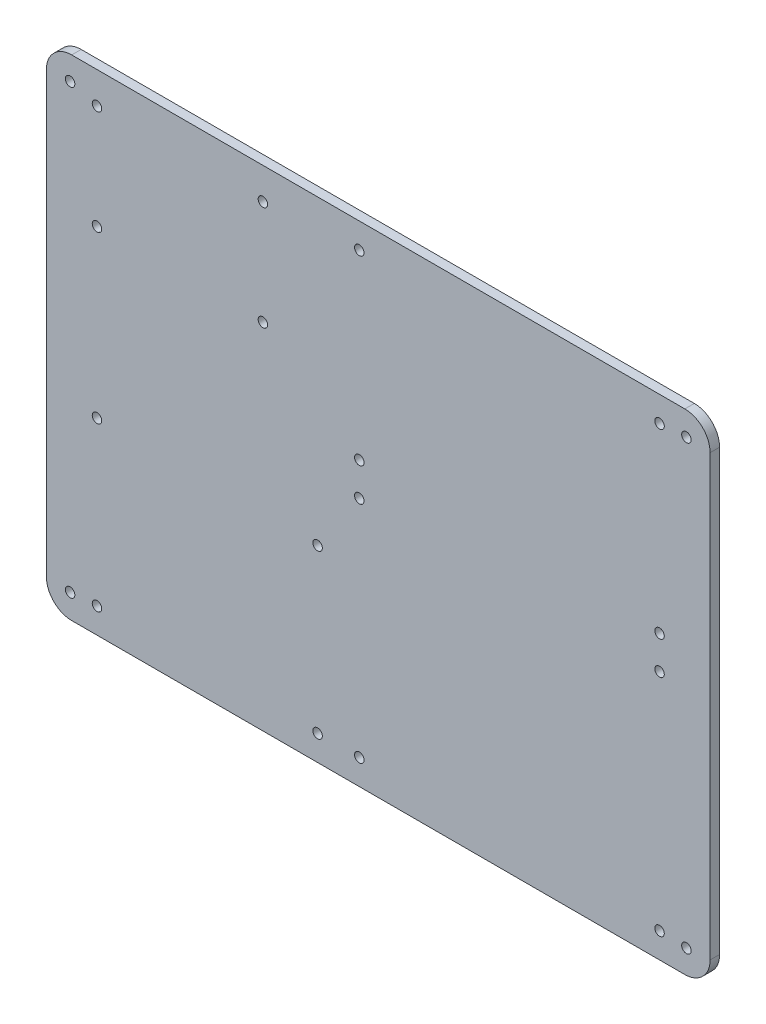
from build123d import *

# Parameters (mm, degrees)
SKETCH1_R           = 1.5
BOSS_EXTRUDE1_DEPTH = 3
SKETCH2_R           = 1.5
LVPCB_HOLE_DEPTH    = 20
SKETCH4_R           = 1.5
SDC_HOLE_DEPTH      = 10
SKETCH3_R           = 1.5
TSAL_LV_HOLE_DEPTH  = 10
SKETCH5_R           = 1.5
BSPD_HOLE_DEPTH     = 10


with BuildPart() as part:
    # Sketch1 → Boss-Extrude1 (new body)
    with BuildSketch(Plane.XY):
        with BuildLine():
            Line((-97, 77.5), (97, 77.5))
            ThreePointArc((97, 77.5), (102.656854249, 75.156854249), (105, 69.5))
            Line((105, 69.5), (105, -69.5))
            ThreePointArc((105, -69.5), (102.656854249, -75.156854249), (97, -77.5))
            Line((97, -77.5), (-97, -77.5))
            ThreePointArc((-97, -77.5), (-102.656854249, -75.156854249), (-105, -69.5))
            Line((-105, -69.5), (-105, 69.5))
            ThreePointArc((-105, 69.5), (-102.656854249, 75.156854249), (-97, 77.5))
        make_face()
        with Locations((-97.5, 70)):
            Circle(SKETCH1_R, mode=Mode.SUBTRACT)
        with Locations((97.5, 70)):
            Circle(SKETCH1_R, mode=Mode.SUBTRACT)
        with Locations((-97.5, -70)):
            Circle(SKETCH1_R, mode=Mode.SUBTRACT)
        with Locations((97.5, -70)):
            Circle(SKETCH1_R, mode=Mode.SUBTRACT)
    extrude(amount=BOSS_EXTRUDE1_DEPTH)

    # Sketch2 → LVPCB Hole (cut)
    with BuildSketch(Plane.XY.offset(3)):
        with Locations((-6, 69.5)):
            Circle(SKETCH2_R)
        with Locations((89, 69.5)):
            Circle(SKETCH2_R)
        with Locations((-6, 12)):
            Circle(SKETCH2_R)
        with Locations((89, 12)):
            Circle(SKETCH2_R)
    extrude(amount=-LVPCB_HOLE_DEPTH, mode=Mode.SUBTRACT)

    # Sketch4 → SDC Hole (cut)
    with BuildSketch(Plane.XY.offset(3)):
        with Locations((-6, 1.5)):
            Circle(SKETCH4_R)
        with Locations((89, 1.5)):
            Circle(SKETCH4_R)
        with Locations((-6, -69.5)):
            Circle(SKETCH4_R)
        with Locations((89, -69.5)):
            Circle(SKETCH4_R)
    extrude(amount=-SDC_HOLE_DEPTH, mode=Mode.SUBTRACT)

    # Sketch3 → TSAL LV Hole (cut)
    with BuildSketch(Plane.XY.offset(3)):
        with Locations((-89, -18)):
            Circle(SKETCH3_R)
        with Locations((-19.2, -18)):
            Circle(SKETCH3_R)
        with Locations((-89, -69.5)):
            Circle(SKETCH3_R)
        with Locations((-19.2, -69.5)):
            Circle(SKETCH3_R)
    extrude(amount=-TSAL_LV_HOLE_DEPTH, mode=Mode.SUBTRACT)

    # Sketch5 → BSPD Hole (cut)
    with BuildSketch(Plane.XY.offset(3)):
        with Locations((-89, 67.5)):
            Circle(SKETCH5_R)
        with Locations((-36.5, 67.5)):
            Circle(SKETCH5_R)
        with Locations((-89, 34.5)):
            Circle(SKETCH5_R)
        with Locations((-36.5, 34.5)):
            Circle(SKETCH5_R)
    extrude(amount=-BSPD_HOLE_DEPTH, mode=Mode.SUBTRACT)


solid = part.part
